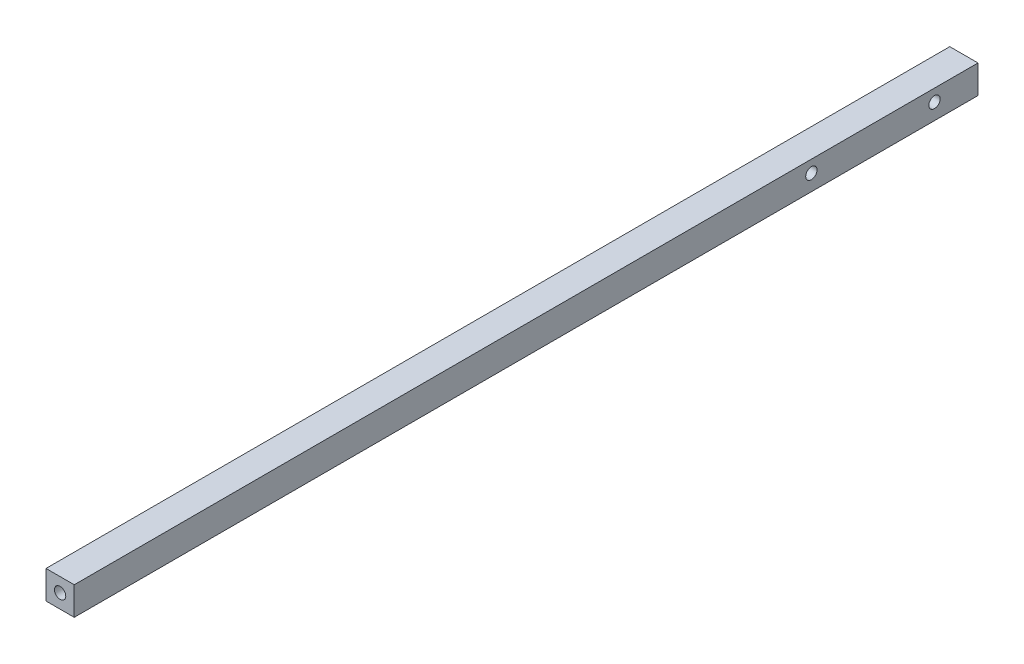
from build123d import *

# Parameters (mm, degrees)
ESQUISSE1_W             = 10
ESQUISSE1_H             = 10
BOSS_EXTRU_1_DEPTH      = 320
ESQUISSE2_R             = 2
ENL_V_MAT_EXTRU_1_DEPTH = 321.312347561
ESQUISSE3_R             = 2
ENL_V_MAT_EXTRU_2_DEPTH = 6
ENL_V_START             = -6
ESQUISSE4_R             = 2
ENL_V_MAT_EXTRU_3_DEPTH = 6


with BuildPart() as part:
    # Esquisse1 → Boss.-Extru.1 (new body)
    with BuildSketch(Plane.XY):
        with Locations((5, 5)):
            Rectangle(ESQUISSE1_W, ESQUISSE1_H)
    extrude(amount=BOSS_EXTRU_1_DEPTH)

    # Esquisse2 → Enlèv. mat.-Extru.1 (cut, through all)
    with BuildSketch(Plane.ZY):
        with Locations((15.4, 5.7)):
            Circle(ESQUISSE2_R)
        with Locations((59, 5.7)):
            Circle(ESQUISSE2_R)
    extrude(amount=-ENL_V_MAT_EXTRU_1_DEPTH, mode=Mode.SUBTRACT)

    # Esquisse3 → Enlèv. mat.-Extru.2 (cut)
    with BuildSketch(Plane(origin=(0, 0, 0), x_dir=(-1, 0, 0), z_dir=(0, 0, -1))):
        with Locations((-5, 5)):
            Circle(ESQUISSE3_R)
    extrude(amount=-ENL_V_MAT_EXTRU_2_DEPTH, mode=Mode.SUBTRACT)

    # Esquisse4 → Enlèv. mat.-Extru.3 (cut)
    with BuildSketch(Plane.XY.offset(320).offset(ENL_V_START)):
        with Locations(Location((5, 5, 0), (0, 0, 180))):
            Circle(ESQUISSE4_R)
    extrude(amount=ENL_V_MAT_EXTRU_3_DEPTH, mode=Mode.SUBTRACT)


solid = part.part
